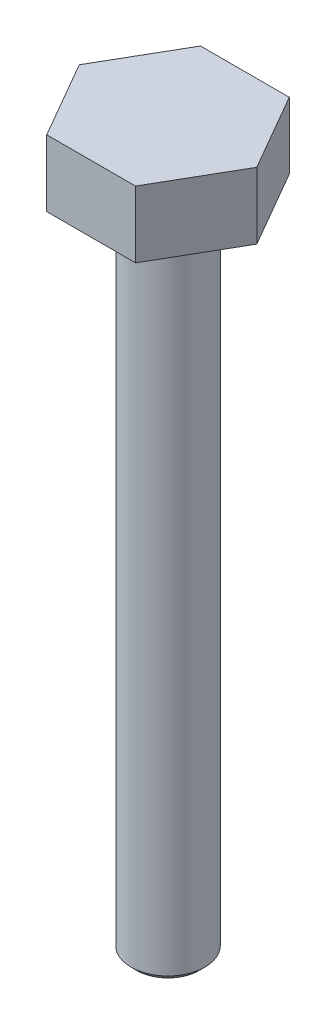
from build123d import *

# Parameters (mm, degrees)
SKETCH2_R                = 25
BOSS_EXTRUDE1_DEPTH      = 45
BOSS_EXTRUDE2_DEPTH      = 45
BOSS_EXTRUDE2_DEPTH_BACK = 445
SKETCH2_3_R              = 25
CHAMFER1_SIZE            = 4


with BuildPart() as part:
    # Sketch2 → Boss-Extrude1 (new body)
    with BuildSketch(Plane(origin=(0, 0, 0), x_dir=(1, 0, 0), z_dir=(0, 1, 0))):
        Polygon((60.044427996, 0), (30.022213998, 52), (-30.022213998, 52), (-60.044427996, 0), (-30.022213998, -52), (30.022213998, -52), align=None)
        Circle(SKETCH2_R, mode=Mode.SUBTRACT)
    extrude(amount=BOSS_EXTRUDE1_DEPTH)

    # Sketch2<3> → Boss-Extrude2 (add, two sides: drawn at the far end of the back side and taken through both)
    with BuildSketch(Plane(origin=(0, 0, 0), x_dir=(1, 0, 0), z_dir=(0, 1, 0)).offset(-BOSS_EXTRUDE2_DEPTH_BACK)):
        Circle(SKETCH2_3_R)
    extrude(amount=BOSS_EXTRUDE2_DEPTH + BOSS_EXTRUDE2_DEPTH_BACK)

    # Chamfer1
    chamfer1_edges = [part.edges().sort_by_distance(p)[0] for p in [
        (-25, -445, 0),
    ]]
    chamfer(chamfer1_edges, length=CHAMFER1_SIZE)


solid = part.part
